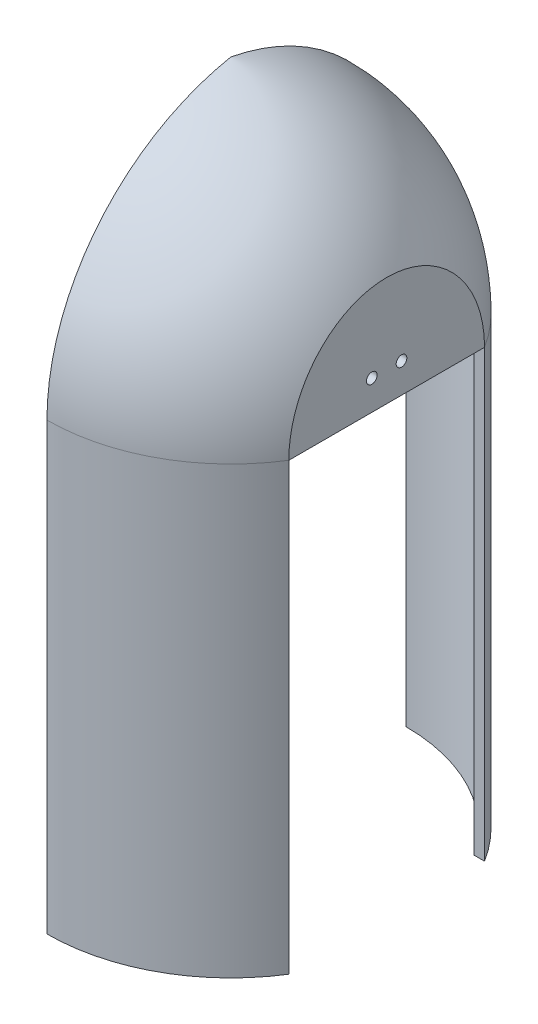
from build123d import *

# Parameters (mm, degrees)
SKETCH2_OUTSIDE_W       = 164.146
SKETCH2_OUTSIDE_H       = 164.146
SKETCH2_OUTSIDE_W_2     = 105
SKETCH2_OUTSIDE_H_2     = 145.767420334
CUT_EXTRUDE2_DEPTH      = 116.381974501
BOSS_EXTRUDE2_REACH     = 112.568
SKETCH3_W               = 3.579145551
SKETCH3_H               = 65.962110336
BOSS_EXTRUDE4_DEPTH     = 150
CUT_EXTRUDE3_DEPTH      = 171.58815789
CUT_EXTRUDE3_DEPTH_BACK = 171.58815789
SKETCH5_W               = 112.520122243
SKETCH5_H               = 235.639617785
CUT_EXTRUDE4_DEPTH      = 171.587954009
CUT_EXTRUDE4_DEPTH_BACK = 171.587954009
SKETCH6_R               = 1.8


with BuildPart() as part:
    # Sketch1 → Revolve1 (revolve)
    with BuildSketch(Plane.XY):
        with BuildLine():
            Line((62, 0), (59, 0))
            ThreePointArc((59, 0), (42.363721251, 46.52102369), (0, 71.943189953))
            Line((0, 71.943189953), (0, 75))
            ThreePointArc((0, 75), (44.493217858, 48.65439343), (62, 0))
        make_face()
    revolve(axis=Axis((0, 75, 0), (0, -1, 0)))

    # Sketch2 outside → Cut-Extrude2 (cut, through all)
    with BuildSketch(Plane(origin=(0, 0, 0), x_dir=(-1, 0, 0), z_dir=(0, -1, 0))):
        Rectangle(SKETCH2_OUTSIDE_W, SKETCH2_OUTSIDE_H)
        Rectangle(SKETCH2_OUTSIDE_W_2, SKETCH2_OUTSIDE_H_2, mode=Mode.SUBTRACT)
    extrude(amount=-CUT_EXTRUDE2_DEPTH, mode=Mode.SUBTRACT)

    # Sketch3 → Boss-Extrude2 (add, up to next)
    with BuildSketch(Plane.XZ, mode=Mode.PRIVATE) as boss_extrude2_sk1:
        with Locations((-50.710427225, 0)):
            Rectangle(SKETCH3_W, SKETCH3_H)
    boss_extrude2_tool1 = extrude(boss_extrude2_sk1.sketch, amount=-BOSS_EXTRUDE2_REACH, mode=Mode.PRIVATE) - part.part
    # Sketch3 → Boss-Extrude2 (add, up to next)
    with BuildSketch(Plane.XZ, mode=Mode.PRIVATE) as boss_extrude2_sk2:
        with Locations((50.710427225, 0)):
            Rectangle(SKETCH3_W, SKETCH3_H)
    boss_extrude2_tool2 = extrude(boss_extrude2_sk2.sketch, amount=-BOSS_EXTRUDE2_REACH, mode=Mode.PRIVATE) - part.part
    add(boss_extrude2_tool1.solids().sort_by_distance((-50.710427, 0, 0))[0])
    add(boss_extrude2_tool2.solids().sort_by_distance((50.710427, 0, 0))[0])

    # Sketch4 → Boss-Extrude4 (add)
    with BuildSketch(Plane(origin=(0, 0, 0), x_dir=(-1, 0, 0), z_dir=(0, -1, 0))):
        with BuildLine():
            Line((52.500662853, -32.98), (48.921565797, -32.98))
            ThreePointArc((48.921565797, -32.98), (0, -59), (-48.921565797, -32.98))
            Line((-48.921565797, -32.98), (-52.500662853, -32.98))
            ThreePointArc((-52.500662853, -32.98), (0, -62), (52.500662853, -32.98))
        make_face()
        with BuildLine():
            Line((-48.921565797, 32.98), (-52.500662853, 32.98))
            ThreePointArc((-52.500662853, 32.98), (0, 62), (52.500662853, 32.98))
            Line((52.500662853, 32.98), (48.921565797, 32.98))
            ThreePointArc((48.921565797, 32.98), (0, 59), (-48.921565797, 32.98))
        make_face()
    extrude(amount=BOSS_EXTRUDE4_DEPTH)

    # Sketch5 → Cut-Extrude3 (cut, two sides: drawn at the far end of the back side and taken through both)
    with BuildSketch(Plane.XY.offset(-CUT_EXTRUDE3_DEPTH_BACK)):
        with Locations((-56.260061122, -36.450714171)):
            Rectangle(SKETCH5_W, SKETCH5_H)
    extrude(amount=CUT_EXTRUDE3_DEPTH + CUT_EXTRUDE3_DEPTH_BACK, mode=Mode.SUBTRACT)

    # Sketch6 → Cut-Extrude4 (cut, two sides: drawn at the far end of the back side and taken through both)
    with BuildSketch(Plane(origin=(52.5, 0, 0), x_dir=(0, 0, -1), z_dir=(1, 0, 0)).offset(-CUT_EXTRUDE4_DEPTH_BACK)):
        with Locations((-5, 10)):
            Circle(SKETCH6_R)
        with Locations((5, 10)):
            Circle(SKETCH6_R)
    extrude(amount=CUT_EXTRUDE4_DEPTH + CUT_EXTRUDE4_DEPTH_BACK, mode=Mode.SUBTRACT)


solid = part.part
